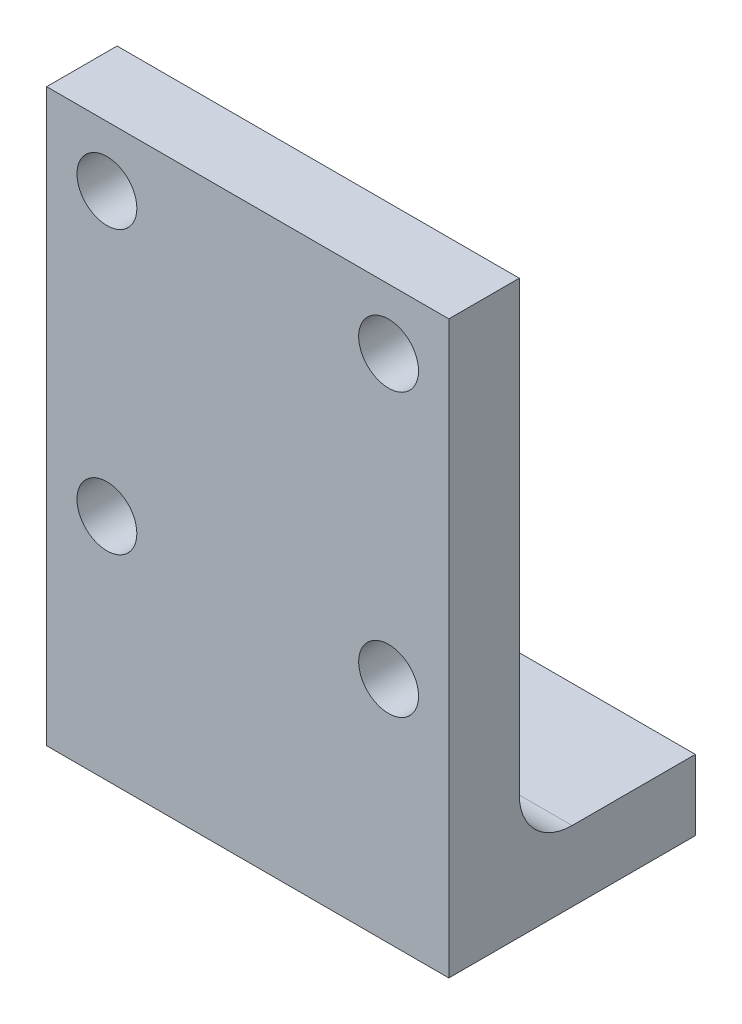
from build123d import *

# Parameters (mm, degrees)
SKETCH1_W           = 22.84372425
SKETCH1_H           = 22.84372425
SKETCH1_R           = 1.7
BOSS_EXTRUDE1_DEPTH = 4
SKETCH2_W           = 22.84372425
SKETCH2_H           = 9.578137875
BOSS_EXTRUDE2_DEPTH = 4
SKETCH3_W           = 22.84372425
SKETCH3_H           = 4
BOSS_EXTRUDE3_DEPTH = 10
FILLET1_R           = 3


with BuildPart() as part:
    # Sketch1 → Boss-Extrude1 (new body)
    with BuildSketch(Plane.XY):
        Rectangle(SKETCH1_W, SKETCH1_H)
        with Locations((-8, 8)):
            Circle(SKETCH1_R, mode=Mode.SUBTRACT)
        with Locations((8, 8)):
            Circle(SKETCH1_R, mode=Mode.SUBTRACT)
        with Locations((8, -8)):
            Circle(SKETCH1_R, mode=Mode.SUBTRACT)
        with Locations((-8, -8)):
            Circle(SKETCH1_R, mode=Mode.SUBTRACT)
    extrude(amount=BOSS_EXTRUDE1_DEPTH)

    # Sketch2 → Boss-Extrude2 (add)
    with BuildSketch(Plane.XY):
        with Locations((0, -16.210931063)):
            Rectangle(SKETCH2_W, SKETCH2_H)
    extrude(amount=BOSS_EXTRUDE2_DEPTH)

    # Sketch3 → Boss-Extrude3 (add)
    with BuildSketch(Plane(origin=(0, 0, 0), x_dir=(-1, 0, 0), z_dir=(0, 0, -1))):
        with Locations((0, -19)):
            Rectangle(SKETCH3_W, SKETCH3_H)
    extrude(amount=BOSS_EXTRUDE3_DEPTH)

    # Fillet1
    fillet1_edges = [part.edges().sort_by_distance(p)[0] for p in [
        (0, -17, 0),
    ]]
    fillet(fillet1_edges, radius=FILLET1_R)


solid = part.part
